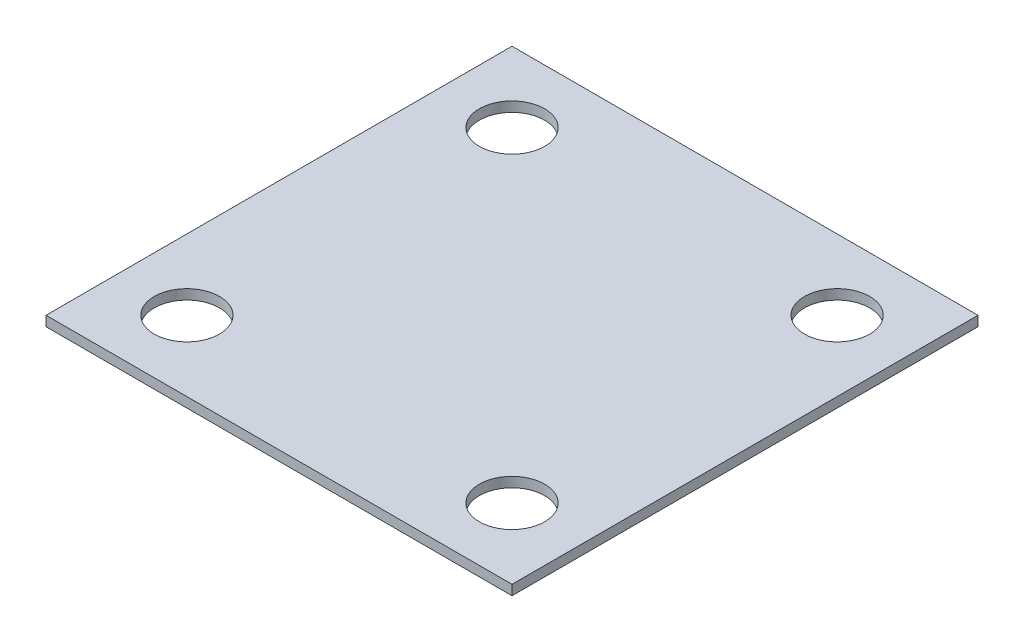
from build123d import *

# Parameters (mm, degrees)
SKETCH1_W           = 75
SKETCH1_H           = 75
SKETCH1_R           = 5.25
BOSS_EXTRUDE1_DEPTH = 1.6


with BuildPart() as part:
    # Sketch1 → Boss-Extrude1 (new body)
    with BuildSketch(Plane(origin=(0, 0, 0), x_dir=(1, 0, 0), z_dir=(0, 1, 0))):
        Rectangle(SKETCH1_W, SKETCH1_H)
        with Locations(Location((-26.1629, -26.1629, 0), (0, 0, 270))):
            Circle(SKETCH1_R, mode=Mode.SUBTRACT)
        with Locations(Location((26.163103615, -26.1629, 0), (0, 0, 270))):
            Circle(SKETCH1_R, mode=Mode.SUBTRACT)
        with Locations(Location((-26.1629, 26.1629, 0), (0, 0, 270))):
            Circle(SKETCH1_R, mode=Mode.SUBTRACT)
        with Locations(Location((26.163103615, 26.1629, 0), (0, 0, 270))):
            Circle(SKETCH1_R, mode=Mode.SUBTRACT)
    extrude(amount=BOSS_EXTRUDE1_DEPTH)


solid = part.part
